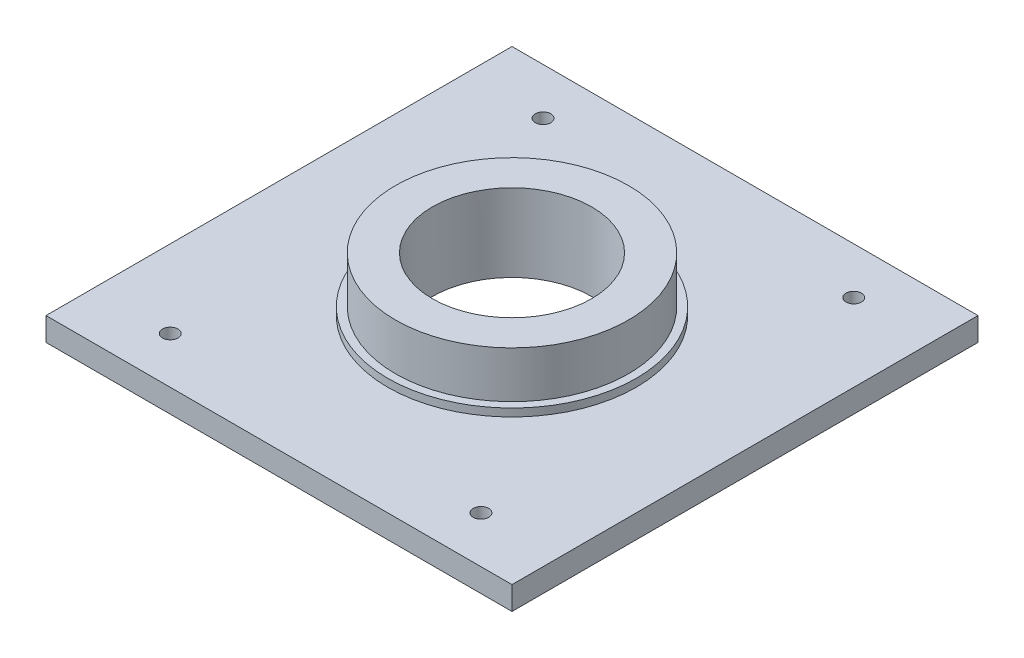
from build123d import *

# Parameters (mm, degrees)
SKETCH1_W           = 60
SKETCH1_H           = 60
BOSS_EXTRUDE1_DEPTH = 3
SKETCH3_R           = 1
CUT_EXTRUDE3_DEPTH  = 43.532340636
SKETCH5_R           = 10.25
CUT_EXTRUDE4_DEPTH  = 43.532340636
SKETCH6_R           = 16
SKETCH6_R_2         = 10.25
BOSS_EXTRUDE2_DEPTH = 1
SKETCH7_R           = 15
SKETCH7_R_2         = 10.25
BOSS_EXTRUDE3_DEPTH = 7


with BuildPart() as part:
    # Sketch1 → Boss-Extrude1 (new body)
    with BuildSketch(Plane(origin=(0, 0, 0), x_dir=(1, 0, 0), z_dir=(0, 1, 0))):
        Rectangle(SKETCH1_W, SKETCH1_H)
    extrude(amount=BOSS_EXTRUDE1_DEPTH)

    # Sketch3 → Cut-Extrude3 (cut, through all)
    with BuildSketch(Plane(origin=(0, 3, 0), x_dir=(1, 0, 0), z_dir=(0, 1, 0))):
        with Locations(Location((-20, 24, 0), (0, 0, 270))):
            Circle(SKETCH3_R)
        with Locations(Location((20, 24, 0), (0, 0, 270))):
            Circle(SKETCH3_R)
        with Locations(Location((-20, -24, 0), (0, 0, 270))):
            Circle(SKETCH3_R)
        with Locations(Location((20, -24, 0), (0, 0, 270))):
            Circle(SKETCH3_R)
    extrude(amount=-CUT_EXTRUDE3_DEPTH, mode=Mode.SUBTRACT)

    # Sketch5 → Cut-Extrude4 (cut, through all)
    with BuildSketch(Plane.XZ):
        with Locations(Location((0, 0, 0), (0, 0, 270))):
            Circle(SKETCH5_R)
    extrude(amount=-CUT_EXTRUDE4_DEPTH, mode=Mode.SUBTRACT)

    # Sketch6 → Boss-Extrude2 (add)
    with BuildSketch(Plane(origin=(0, 3, 0), x_dir=(1, 0, 0), z_dir=(0, 1, 0))):
        with Locations(Location((0, 0, 0), (0, 0, 270))):
            Circle(SKETCH6_R)
        with Locations(Location((0, 0, 0), (0, 0, 90))):
            Circle(SKETCH6_R_2, mode=Mode.SUBTRACT)
    extrude(amount=BOSS_EXTRUDE2_DEPTH)

    # Sketch7 → Boss-Extrude3 (add)
    with BuildSketch(Plane(origin=(0, 3, 0), x_dir=(1, 0, 0), z_dir=(0, 1, 0))):
        with Locations(Location((0, 0, 0), (0, 0, 270))):
            Circle(SKETCH7_R)
        with Locations(Location((0, 0, 0), (0, 0, 90))):
            Circle(SKETCH7_R_2, mode=Mode.SUBTRACT)
    extrude(amount=BOSS_EXTRUDE3_DEPTH)


solid = part.part
